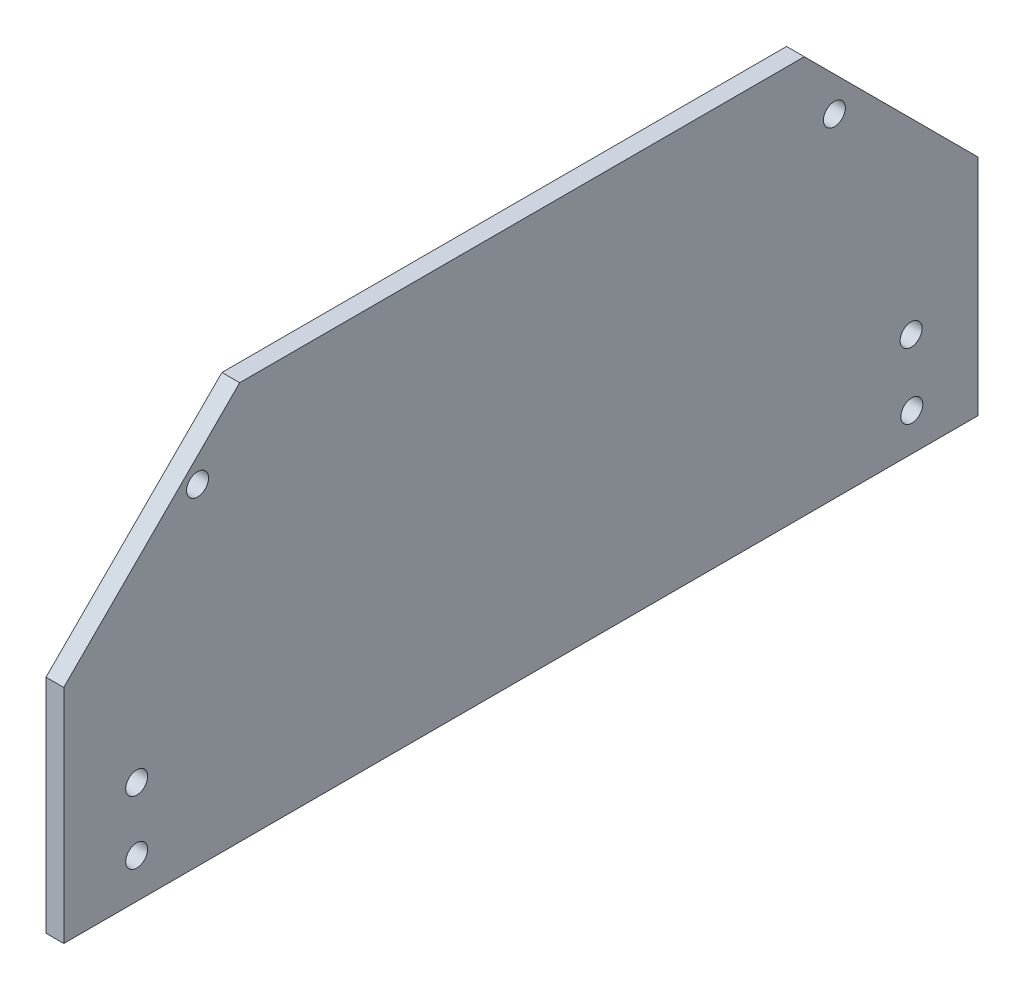
from build123d import *

# Parameters (mm, degrees)
SKETCH1_R           = 1.85399934
BOSS_EXTRUDE1_DEPTH = 3


with BuildPart() as part:
    # Sketch1 → Boss-Extrude1 (new body)
    with BuildSketch(Plane(origin=(0, 0, 0), x_dir=(0, 0, -1), z_dir=(1, 0, 0))):
        Polygon((0, 0), (0, 37.465), (29.718, 67.183), (125.095, 67.183), (154.432, 37.846), (154.432, 0), align=None)
        with Locations((12.319, 17.399)):
            Circle(SKETCH1_R, mode=Mode.SUBTRACT)
        with Locations((12.319, 6.731)):
            Circle(SKETCH1_R, mode=Mode.SUBTRACT)
        with Locations((22.606, 55.88)):
            Circle(SKETCH1_R, mode=Mode.SUBTRACT)
        with Locations((130.175, 56.261)):
            Circle(SKETCH1_R, mode=Mode.SUBTRACT)
        with Locations((143.256, 6.35)):
            Circle(SKETCH1_R, mode=Mode.SUBTRACT)
        with Locations((143.129, 17.526)):
            Circle(SKETCH1_R, mode=Mode.SUBTRACT)
    extrude(amount=BOSS_EXTRUDE1_DEPTH)


solid = part.part
